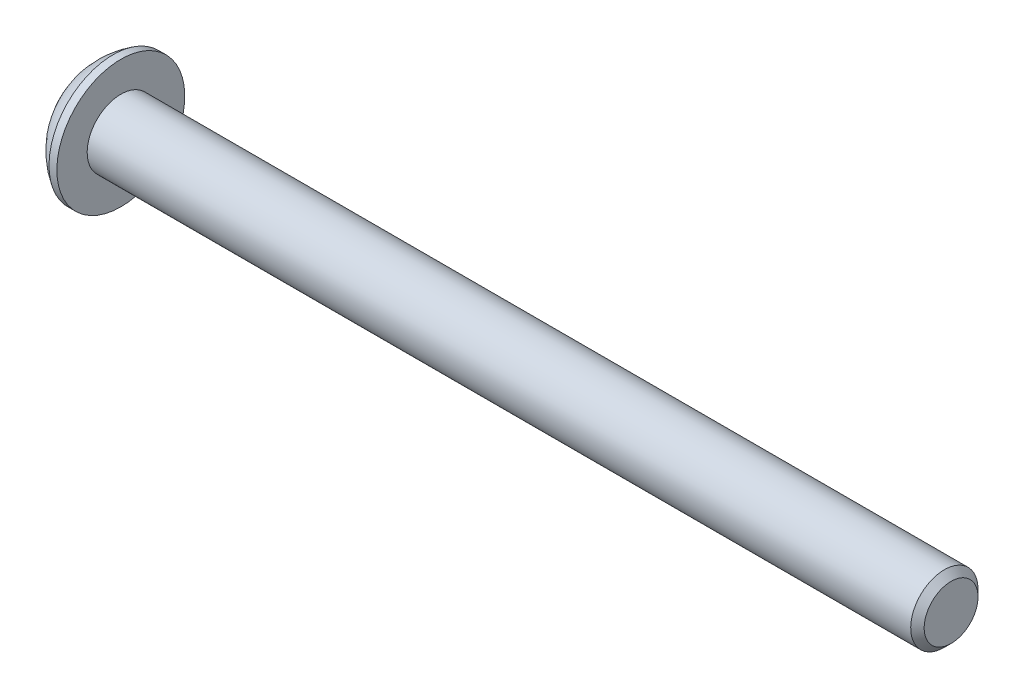
from build123d import *

# Parameters (mm, degrees)
CUT_EXTRUDE1_DEPTH = 1
CHAMFER1_SIZE      = 0.3


with BuildPart() as part:
    # Sketch1 → Revolve1 (revolve)
    with BuildSketch(Plane.XY, mode=Mode.PRIVATE) as revolve1_sk:
        with BuildLine():
            Line((-38.65, 0), (-38.65, 1.425))
            ThreePointArc((-38.65, 1.425), (-38.104780452, 2.233089184), (-37.35, 2.85))
            Line((-37.35, 2.85), (-37, 2.85))
            Line((-37, 2.85), (-37, 1.5))
            Line((-37, 1.5), (0, 1.5))
            Line((0, 1.5), (0, 0))
            Line((0, 0), (-38.65, 0))
        make_face()
    revolve(revolve1_sk.sketch.rotate(Axis((-45.185840708, 0, 0), (1, 0, 0)), 180), axis=Axis((-45.185840708, 0, 0), (1, 0, 0)))

    # Sketch2 → Cut-Extrude1 (cut)
    with BuildSketch(Plane.ZY.offset(38.65)):
        Polygon((0, 1.154700538), (-1, 0.577350269), (-1, -0.577350269), (0, -1.154700538), (1, -0.577350269), (1, 0.577350269), align=None)
    extrude(amount=-CUT_EXTRUDE1_DEPTH, mode=Mode.SUBTRACT)

    # Chamfer1
    chamfer1_edges = [part.edges().sort_by_distance(p)[0] for p in [
        (0, 1.5, 0),
    ]]
    chamfer(chamfer1_edges, length=CHAMFER1_SIZE)


solid = part.part
